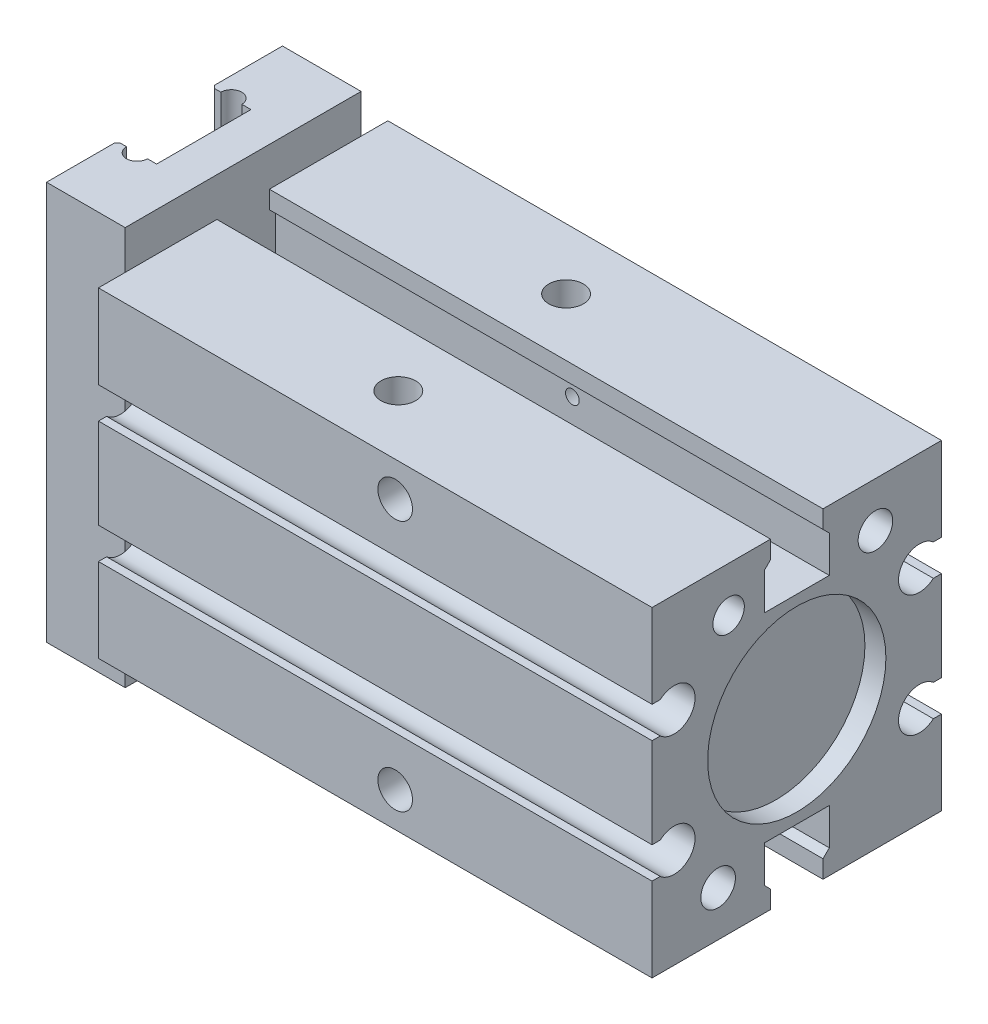
from build123d import *

# Parameters (mm, degrees)
SKETCH1_W                    = 52.8
SKETCH1_H                    = 30.6
EXT_BODY_DEPTH               = 13.8
AUTO_SWITCH_MOUNTING_DEPTH   = 57.677773421
SKETCH3_R                    = 8.5
CYL_BORE_DEPTH               = 2
M4X0_7_TAPPED_HOLE1_D        = 3.3
M4X0_7_TAPPED_HOLE1_DEPTH    = 10.1
M4X0_7_TAPPED_HOLE1_TIP      = 0.991420021
F_3_0_3_DIAMETER_HOLE1_D     = 3
F_3_0_3_DIAMETER_HOLE1_DEPTH = 3
F_3_0_3_DIAMETER_HOLE1_TIP   = 0.901290929
M4X0_7_TAPPED_HOLE2_D        = 3.3
M4X0_7_TAPPED_HOLE2_DEPTH    = 10.1
M4X0_7_TAPPED_HOLE2_TIP      = 0.991420021
M4X0_7_TAPPED_HOLE3_D        = 3.3
M4X0_7_TAPPED_HOLE3_DEPTH    = 10.1
M4X0_7_TAPPED_HOLE3_TIP      = 0.991420021
M4X0_7_TAPPED_HOLE4_D        = 3.3
M4X0_7_TAPPED_HOLE4_DEPTH    = 6.6
M4X0_7_TAPPED_HOLE4_TIP      = 0.991420021
M5X0_8_TAPPED_HOLE1_D        = 4.2
M5X0_8_TAPPED_HOLE1_DEPTH    = 6
M5X0_8_TAPPED_HOLE1_TIP      = 1.2618073
BOSS_EXTRUDE2_DEPTH          = 19
CHAMFER1_SIZE                = 0.25


with BuildPart() as part:
    # Sketch1 → EXT BODY (new, symmetric)
    with BuildSketch(Plane.XY):
        Rectangle(SKETCH1_W, SKETCH1_H)
    extrude(amount=EXT_BODY_DEPTH, both=True)

    # Sketch2 → AUTO SWITCH MOUNTING (cut, through all)
    with BuildSketch(Plane(origin=(26.4, 0, 0), x_dir=(0, 0, -1), z_dir=(1, 0, 0))):
        Polygon((2.5, 15.3), (-2.5, 15.3), (-2.5, 13.6), (-3.1, 13), (-3.1, 9.5), (3.1, 9.5), (3.1, 13), (2.5, 13.6), align=None)
        with BuildLine():
            Line((-13.022875656, 7.3), (-13.8, 7.3))
            Line((-13.8, 7.3), (-13.8, 4.3))
            Line((-13.8, 4.3), (-13.022875656, 4.3))
            ThreePointArc((-13.022875656, 4.3), (-9.7, 5.8), (-13.022875656, 7.3))
        make_face()
        with BuildLine():
            Line((-13.8, -7.3), (-13.8, -4.3))
            Line((-13.8, -4.3), (-13.022875656, -4.3))
            ThreePointArc((-13.022875656, -4.3), (-9.7, -5.8), (-13.022875656, -7.3))
            Line((-13.022875656, -7.3), (-13.8, -7.3))
        make_face()
        Polygon((-3.1, -9.5), (3.1, -9.5), (3.1, -13), (2.5, -13.6), (2.5, -15.3), (-2.5, -15.3), (-2.5, -13.6), (-3.1, -13), align=None)
        with BuildLine():
            Line((13.022875656, -7.3), (13.8, -7.3))
            Line((13.8, -7.3), (13.8, -4.3))
            Line((13.8, -4.3), (13.022875656, -4.3))
            ThreePointArc((13.022875656, -4.3), (9.7, -5.8), (13.022875656, -7.3))
        make_face()
        with BuildLine():
            Line((13.8, 7.3), (13.8, 4.3))
            Line((13.8, 4.3), (13.022875656, 4.3))
            ThreePointArc((13.022875656, 4.3), (9.7, 5.8), (13.022875656, 7.3))
            Line((13.022875656, 7.3), (13.8, 7.3))
        make_face()
    extrude(amount=-AUTO_SWITCH_MOUNTING_DEPTH, mode=Mode.SUBTRACT)

    # Sketch3 → CYL BORE (cut)
    with BuildSketch(Plane(origin=(26.4, 0, 0), x_dir=(0, 0, -1), z_dir=(1, 0, 0))):
        Circle(SKETCH3_R)
    extrude(amount=-CYL_BORE_DEPTH, mode=Mode.SUBTRACT)

    # M4x0.7 Tapped Hole1
    with Locations(Plane(origin=(26.4, 0, 0), x_dir=(0, 0, -1), z_dir=(1, 0, 0))):
        with Locations((-7.5, -11), (7.5, 11)):
            Hole(M4X0_7_TAPPED_HOLE1_D / 2, depth=M4X0_7_TAPPED_HOLE1_DEPTH)
            with Locations((0, 0, -(M4X0_7_TAPPED_HOLE1_DEPTH + M4X0_7_TAPPED_HOLE1_TIP / 2))):  # 118° drill point
                Cone(0, M4X0_7_TAPPED_HOLE1_D / 2, M4X0_7_TAPPED_HOLE1_TIP, mode=Mode.SUBTRACT)

    # Ø3.0 (3) Diameter Hole1
    with Locations(Plane(origin=(26.4, 0, 0), x_dir=(0, 0, -1), z_dir=(1, 0, 0))):
        with Locations((-6.5, 11)):
            Hole(F_3_0_3_DIAMETER_HOLE1_D / 2, depth=F_3_0_3_DIAMETER_HOLE1_DEPTH)
            with Locations((0, 0, -(F_3_0_3_DIAMETER_HOLE1_DEPTH + F_3_0_3_DIAMETER_HOLE1_TIP / 2))):  # 118° drill point
                Cone(0, F_3_0_3_DIAMETER_HOLE1_D / 2, F_3_0_3_DIAMETER_HOLE1_TIP, mode=Mode.SUBTRACT)

    # M4x0.7 Tapped Hole2
    with Locations(Plane.XY.offset(13.8)):
        with Locations((1.9, 12), (1.9, -12)):
            Hole(M4X0_7_TAPPED_HOLE2_D / 2, depth=M4X0_7_TAPPED_HOLE2_DEPTH)
            with Locations((0, 0, -(M4X0_7_TAPPED_HOLE2_DEPTH + M4X0_7_TAPPED_HOLE2_TIP / 2))):  # 118° drill point
                Cone(0, M4X0_7_TAPPED_HOLE2_D / 2, M4X0_7_TAPPED_HOLE2_TIP, mode=Mode.SUBTRACT)

    # M4x0.7 Tapped Hole3
    with Locations(Plane(origin=(0, 0, -13.8), x_dir=(-1, 0, 0), z_dir=(0, 0, -1))):
        with Locations((-1.9, 12), (-1.9, -12)):
            Hole(M4X0_7_TAPPED_HOLE3_D / 2, depth=M4X0_7_TAPPED_HOLE3_DEPTH)
            with Locations((0, 0, -(M4X0_7_TAPPED_HOLE3_DEPTH + M4X0_7_TAPPED_HOLE3_TIP / 2))):  # 118° drill point
                Cone(0, M4X0_7_TAPPED_HOLE3_D / 2, M4X0_7_TAPPED_HOLE3_TIP, mode=Mode.SUBTRACT)

    # M4x0.7 Tapped Hole4
    with Locations(Plane(origin=(0, 15.3, 0), x_dir=(1, 0, 0), z_dir=(0, 1, 0))):
        with Locations((-3.6, 8), (-3.6, -8)):
            Hole(M4X0_7_TAPPED_HOLE4_D / 2, depth=M4X0_7_TAPPED_HOLE4_DEPTH)
            with Locations((0, 0, -(M4X0_7_TAPPED_HOLE4_DEPTH + M4X0_7_TAPPED_HOLE4_TIP / 2))):  # 118° drill point
                Cone(0, M4X0_7_TAPPED_HOLE4_D / 2, M4X0_7_TAPPED_HOLE4_TIP, mode=Mode.SUBTRACT)

    # M5x0.8 Tapped Hole1
    with Locations(Plane(origin=(0, -15.3, 0), x_dir=(-1, 0, 0), z_dir=(0, -1, 0))):
        with Locations((-7.4, -7.5), (-18.9, 7.5)):
            Hole(M5X0_8_TAPPED_HOLE1_D / 2, depth=M5X0_8_TAPPED_HOLE1_DEPTH)
            with Locations((0, 0, -(M5X0_8_TAPPED_HOLE1_DEPTH + M5X0_8_TAPPED_HOLE1_TIP / 2))):  # 118° drill point
                Cone(0, M5X0_8_TAPPED_HOLE1_D / 2, M5X0_8_TAPPED_HOLE1_TIP, mode=Mode.SUBTRACT)

    # Sketch21 → Boss-Extrude2 (add, symmetric)
    with BuildSketch(Plane(origin=(0, 0, 0), x_dir=(1, 0, 0), z_dir=(0, 1, 0))):
        with BuildLine():
            Line((-33.9, 4.5), (-33.9, 11.25))
            Line((-33.9, 11.25), (-26.4, 11.25))
            Line((-26.4, 11.25), (-26.4, -11.25))
            Line((-26.4, -11.25), (-33.9, -11.25))
            Line((-33.9, -11.25), (-33.9, -4.5))
            Line((-33.9, -4.5), (-33.025, -4.5))
            ThreePointArc((-33.025, -4.5), (-32.025, -5.5), (-31.025, -4.5))
            Line((-31.025, -4.5), (-30.15, -4.5))
            Line((-30.15, -4.5), (-30.15, 4.5))
            Line((-30.15, 4.5), (-31.025, 4.5))
            ThreePointArc((-31.025, 4.5), (-32.025, 5.5), (-33.025, 4.5))
            Line((-33.025, 4.5), (-33.9, 4.5))
        make_face()
    extrude(amount=BOSS_EXTRUDE2_DEPTH, both=True)

    # Chamfer1
    chamfer1_edges = [part.edges().sort_by_distance(p)[0] for p in [
        (-33.9, 0, -4.5),
        (-33.9, 0, 4.5),
    ]]
    chamfer(chamfer1_edges, length=CHAMFER1_SIZE)


solid = part.part
